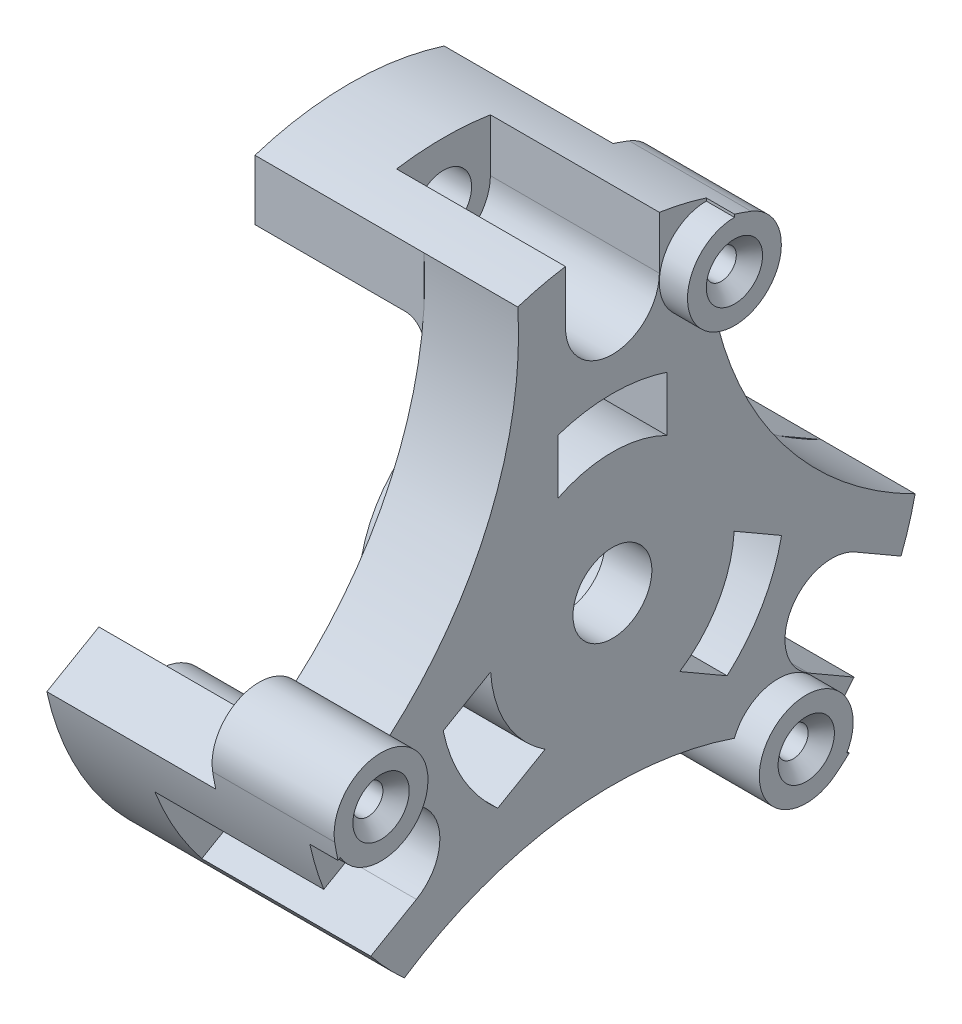
from build123d import *
from build123d.topology import SkipClean

# Parameters (mm, degrees)
SKETCH_2_R                           = 20
CUT_EXTRUDE_1_DEPTH                  = 10
PATTERN_CIRCULAR_1_COUNT             = 3
CUT_EXTRUDE_START                    = -10
CUT_EXTRUDE_2_DEPTH                  = 10
PATTERN_CIRCULAR_2_COUNT             = 3
SKETCH_4_R                           = 1.5
EXTRUDE_1_DEPTH                      = 9
PATTERN_CIRCULAR_3_COUNT             = 3
SKETCH_5_W                           = 6.1
SKETCH_5_H                           = 4.309181557
CUT_EXTRUDE_3_DEPTH                  = 1.5
PATTERN_CIRCULAR_4_COUNT             = 3
CUT_EXTRUDE_4_DEPTH                  = 9
PATTERN_CIRCULAR_5_COUNT             = 3
EXTRUDE_START                        = -6.5
EXTRUDE_2_DEPTH                      = 6.5
SKETCH_9_R                           = 0.8
CUT_EXTRUDE_7_DEPTH                  = 6.4
CHAMFER_3_SIZE                       = 0.7
PATTERN_CIRCULAR_8_COUNT             = 3
CHAMFER_3_OF_PATTERN_CIRCULAR_8_SIZE = 0.7
FILLET_2_R                           = 1
FILLET_3_R                           = 1
CHAMFER_4_SIZE                       = 0.3


with BuildPart() as part:
    # 草图1 → 旋转1 (revolve)
    with BuildSketch(Plane.XY, mode=Mode.PRIVATE) as revolve_1_sk:
        Polygon((-7, 6.5), (-5, 6.5), (-5, 16.5), (0, 16.5), (0, 2.1), (-2.5, 2.1), (-2.5, 4), (-7, 4), align=None)
    revolve(revolve_1_sk.sketch.rotate(Axis((-65.742857143, 0, 0), (1, 0, 0)), 90), axis=Axis((-65.742857143, 0, 0), (1, 0, 0)))

    # 草图2 → 切除-拉伸1 (cut)
    with BuildSketch(Plane.ZY.offset(5)):
        with Locations((-25, 14.43375673)):
            Circle(SKETCH_2_R)
    cut_extrude_1 = extrude(amount=-CUT_EXTRUDE_1_DEPTH, mode=Mode.SUBTRACT)

    # 阵列(圆周)1: 切除-拉伸1 ×3 about axis
    pattern_circular_1_axis = Axis((0, 0, 0), (1, 0, 0))
    for i in range(1, PATTERN_CIRCULAR_1_COUNT):
        add(cut_extrude_1.rotate(pattern_circular_1_axis, i * 360 / PATTERN_CIRCULAR_1_COUNT), mode=Mode.SUBTRACT)

    # 草图3 → 切除-拉伸2 (cut)
    with BuildSketch(Plane.ZY.offset(5).offset(CUT_EXTRUDE_START)):
        with BuildLine():
            Line((-2.9, 8.730979327), (-2.9, 5.817215829))
            ThreePointArc((-2.9, 5.817215829), (0, 6.5), (2.9, 5.817215829))
            Line((2.9, 5.817215829), (2.9, 8.730979327))
            ThreePointArc((2.9, 8.730979327), (0, 9.2), (-2.9, 8.730979327))
        make_face()
    cut_extrude_2 = extrude(amount=CUT_EXTRUDE_2_DEPTH, mode=Mode.SUBTRACT)

    # 阵列(圆周)2: 切除-拉伸2 ×3 about axis
    pattern_circular_2_axis = Axis((0, 0, 0), (1, 0, 0))
    for i in range(1, PATTERN_CIRCULAR_2_COUNT):
        add(cut_extrude_2.rotate(pattern_circular_2_axis, i * 360 / PATTERN_CIRCULAR_2_COUNT), mode=Mode.SUBTRACT)

    # 草图4 → 凸台-拉伸1 (add)
    with BuildSketch(Plane.ZY.offset(5)):
        with BuildLine():
            Line((-5.040834524, 15.711142139), (-5.040834524, 12.511142139))
            Line((-5.040834524, 12.511142139), (-2.619572509, 12.511142139))
            ThreePointArc((-2.619572509, 12.511142139), (0, 10.7), (2.619572509, 12.511142139))
            Line((2.619572509, 12.511142139), (5.040834524, 12.511142139))
            Line((5.040834524, 12.511142139), (5.040834524, 15.711142139))
            ThreePointArc((5.040834524, 15.711142139), (0, 16.5), (-5.040834524, 15.711142139))
        make_face()
        with Locations((0, 13.5)):
            Circle(SKETCH_4_R, mode=Mode.SUBTRACT)
    extrude_1 = extrude(amount=EXTRUDE_1_DEPTH)

    # 阵列(圆周)3: 凸台-拉伸1 ×3 about axis
    pattern_circular_3_axis = Axis((0, 0, 0), (1, 0, 0))
    for i in range(1, PATTERN_CIRCULAR_3_COUNT):
        add(extrude_1.rotate(pattern_circular_3_axis, i * 360 / PATTERN_CIRCULAR_3_COUNT))

    # 草图5 → 切除-拉伸3 (cut)
    with BuildSketch(Plane.ZY.offset(14)):
        with Locations((0, 11.445409222)):
            Rectangle(SKETCH_5_W, SKETCH_5_H)
    cut_extrude_3 = extrude(amount=-CUT_EXTRUDE_3_DEPTH, mode=Mode.SUBTRACT)

    # 阵列(圆周)4: 切除-拉伸3 ×3 about axis
    pattern_circular_4_axis = Axis((0, 0, 0), (1, 0, 0))
    for i in range(1, PATTERN_CIRCULAR_4_COUNT):
        add(cut_extrude_3.rotate(pattern_circular_4_axis, i * 360 / PATTERN_CIRCULAR_4_COUNT), mode=Mode.SUBTRACT)

    # 草图6 → 切除-拉伸4 (cut)
    with BuildSketch(Plane(origin=(0, 0, 0), x_dir=(0, 0, -1), z_dir=(1, 0, 0))):
        with BuildLine():
            Line((-2.5, 16.30950643), (-2.5, 13.5))
            ThreePointArc((-2.5, 13.5), (0, 11), (2.5, 13.5))
            Line((2.5, 13.5), (2.5, 16.30950643))
            ThreePointArc((2.5, 16.30950643), (0, 16.5), (-2.5, 16.30950643))
        make_face()
    cut_extrude_4 = extrude(amount=-CUT_EXTRUDE_4_DEPTH, mode=Mode.SUBTRACT)

    # 阵列(圆周)5: 切除-拉伸4 ×3 about axis
    pattern_circular_5_axis = Axis((0, 0, 0), (1, 0, 0))
    for i in range(1, PATTERN_CIRCULAR_5_COUNT):
        add(cut_extrude_4.rotate(pattern_circular_5_axis, i * 360 / PATTERN_CIRCULAR_5_COUNT), mode=Mode.SUBTRACT)

    # 草图7 → 凸台-拉伸2 (add)
    with BuildSketch(Plane.ZY.offset(5).offset(EXTRUDE_START)):
        with BuildLine():
            Line((-5, 15.576696831), (-5, 15.724185194))
            ThreePointArc((-5, 15.724185194), (-5.448667451, 15.574402814), (-5.892857143, 15.411821265))
            ThreePointArc((-5.892857143, 15.411821265), (-4.546023726, 10.618261242), (-5, 15.576696831))
        make_face()
    extrude_2 = extrude(amount=EXTRUDE_2_DEPTH)

    # 草图9 → 切除-拉伸7 (cut)
    with SkipClean():  # the faces are left unmerged after this step: merging them gives an invalid solid
        with BuildSketch(Plane(origin=(1.5, 0, 0), x_dir=(0, 0, -1), z_dir=(1, 0, 0))):
            with Locations((5, 13.076696831)):
                Circle(SKETCH_9_R)
        cut_extrude_7 = extrude(amount=-CUT_EXTRUDE_7_DEPTH, mode=Mode.SUBTRACT)

    # 倒角3
    chamfer_3_edges = [part.edges().sort_by_distance(p)[0] for p in [
        (1.5, 13.076696831, -4.2),
    ]]
    chamfer(chamfer_3_edges, length=CHAMFER_3_SIZE)

    # 阵列(圆周)8: 凸台-拉伸2, 切除-拉伸7 ×3 about axis
    with SkipClean():  # the faces are left unmerged after this step: merging them gives an invalid solid
        pattern_circular_8_axis = Axis((0, 0, 0), (1, 0, 0))
        add([extrude_2.rotate(pattern_circular_8_axis, i * 360 / PATTERN_CIRCULAR_8_COUNT) for i in range(1, PATTERN_CIRCULAR_8_COUNT)])
        add([cut_extrude_7.rotate(pattern_circular_8_axis, i * 360 / PATTERN_CIRCULAR_8_COUNT) for i in range(1, PATTERN_CIRCULAR_8_COUNT)], mode=Mode.SUBTRACT)

    # 倒角3 of 阵列(圆周)8
    chamfer_3_of_pattern_circular_8_edges = [part.edges().sort_by_distance(p)[0] for p in [
        (1.5, -2.901041719, 13.424751653),
        (1.5, -10.175655111, -9.224751653),
    ]]
    chamfer(chamfer_3_of_pattern_circular_8_edges, length=CHAMFER_3_OF_PATTERN_CIRCULAR_8_SIZE)

    # 圆角2
    fillet_2_edges = [part.edges().sort_by_distance(p)[0] for p in [
        (-5, 12.511142139, -3.830203516),
        (-5, 10.7, 0),
        (-5, 12.511142139, 3.830203516),
    ]]
    fillet(fillet_2_edges, radius=FILLET_2_R)

    # 圆角3
    fillet_3_edges = [part.edges().sort_by_distance(p)[0] for p in [
        (-5, -9.572624616, -8.919865164),
        (-5, -5.35, -9.26647182),
        (-5, -2.938517523, -12.750068681),
        (-5, -2.938517523, 12.750068681),
        (-5, -5.35, 9.26647182),
        (-5, -9.572624616, 8.919865164),
    ]]
    fillet(fillet_3_edges, radius=FILLET_3_R)

    # 倒角4
    chamfer_4_edges = [part.edges().sort_by_distance(p)[0] for p in [
        (-7, 0, -4),
    ]]
    chamfer(chamfer_4_edges, length=CHAMFER_4_SIZE)


solid = part.part
